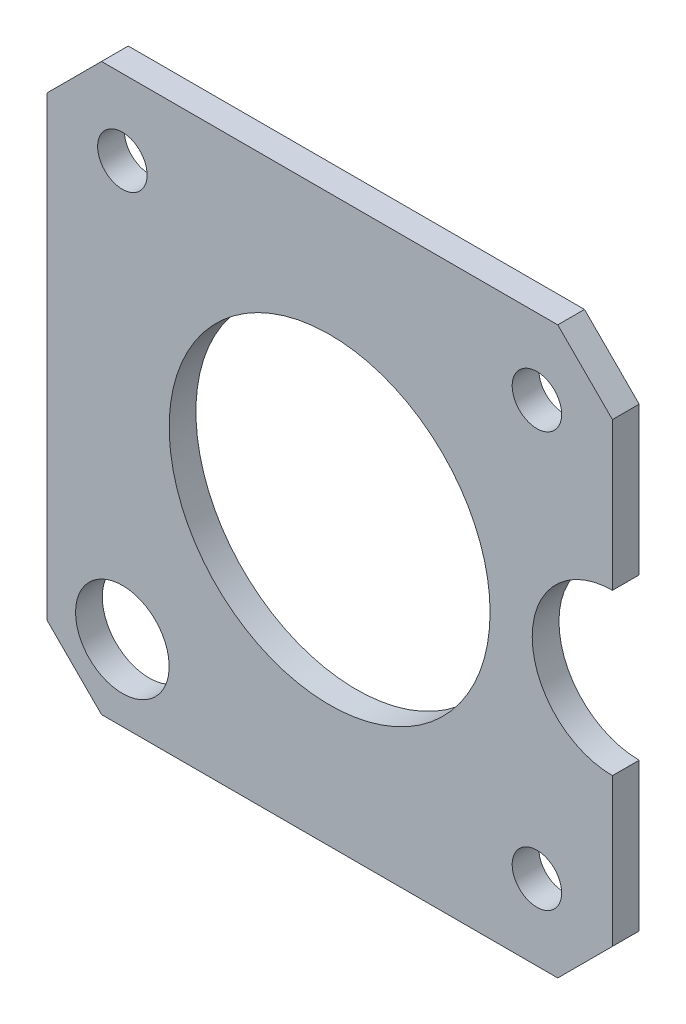
from build123d import *

# Parameters (mm, degrees)
CROQUIS1_W              = 42.3
CROQUIS1_H              = 42.3
CROQUIS1_R              = 1.85
CROQUIS1_R_2            = 12
SALIENTE_EXTRUIR1_DEPTH = 2
CHAFL_N1_SIZE           = 4.09
CROQUIS2_R              = 6
CORTAR_EXTRUIR1_DEPTH   = 60.854657296
CROQUIS4_R              = 3.5
CORTAR_EXTRUIR3_DEPTH   = 60.854657296


with BuildPart() as part:
    # Croquis1 → Saliente-Extruir1 (new body)
    with BuildSketch(Plane.XY):
        with Locations((21.15, 21.15)):
            Rectangle(CROQUIS1_W, CROQUIS1_H)
        with Locations((5.65, 36.65)):
            Circle(CROQUIS1_R, mode=Mode.SUBTRACT)
        with Locations((5.65, 5.65)):
            Circle(CROQUIS1_R, mode=Mode.SUBTRACT)
        with Locations(Location((36.65, 5.65, 0), (0, 0, 180))):
            Circle(CROQUIS1_R, mode=Mode.SUBTRACT)
        with Locations(Location((36.65, 36.65, 0), (0, 0, 180))):
            Circle(CROQUIS1_R, mode=Mode.SUBTRACT)
        with Locations((21.15, 21.15)):
            Circle(CROQUIS1_R_2, mode=Mode.SUBTRACT)
    extrude(amount=SALIENTE_EXTRUIR1_DEPTH)

    # Chaflán1
    chafl_n1_edges = [part.edges().sort_by_distance(p)[0] for p in [
        (0, 42.3, 1),
        (42.3, 42.3, 1),
        (42.3, 0, 1),
        (0, 0, 1),
    ]]
    chamfer(chafl_n1_edges, length=CHAFL_N1_SIZE)

    # Croquis2 → Cortar-Extruir1 (cut, through all)
    with BuildSketch(Plane(origin=(0, 0, 0), x_dir=(-1, 0, 0), z_dir=(0, 0, -1))):
        with Locations((-42.3, 21.15)):
            Circle(CROQUIS2_R)
    extrude(amount=-CORTAR_EXTRUIR1_DEPTH, mode=Mode.SUBTRACT)

    # Croquis4 → Cortar-Extruir3 (cut, through all)
    with BuildSketch(Plane(origin=(0, 0, 0), x_dir=(-1, 0, 0), z_dir=(0, 0, -1))):
        with Locations((-5.65, 5.65)):
            Circle(CROQUIS4_R)
    extrude(amount=-CORTAR_EXTRUIR3_DEPTH, mode=Mode.SUBTRACT)


solid = part.part
